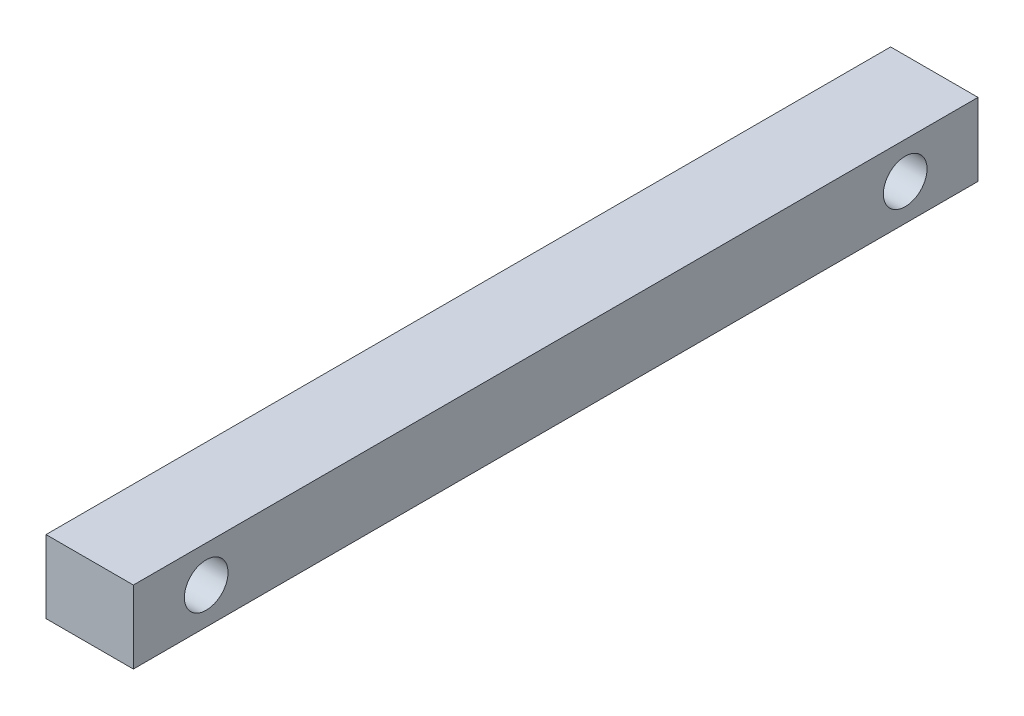
from build123d import *

# Parameters (mm, degrees)
ESBO_O1_W                = 30
ESBO_O1_H                = 25
RESSALTO_EXTRUS_O2_DEPTH = 290
ESBO_O2_R                = 7.5
CORTE_EXTRUS_O1_DEPTH    = 290


with BuildPart() as part:
    # Esboço1 → Ressalto-extrusão2 (new body)
    with BuildSketch(Plane.XY):
        Rectangle(ESBO_O1_W, ESBO_O1_H)
    extrude(amount=RESSALTO_EXTRUS_O2_DEPTH)

    # Esboço2 → Corte-extrusão1 (cut)
    with BuildSketch(Plane.ZY.offset(15)):
        with Locations((25, 0)):
            Circle(ESBO_O2_R)
        with Locations((265, 0)):
            Circle(ESBO_O2_R)
    extrude(amount=-CORTE_EXTRUS_O1_DEPTH, mode=Mode.SUBTRACT)


solid = part.part
